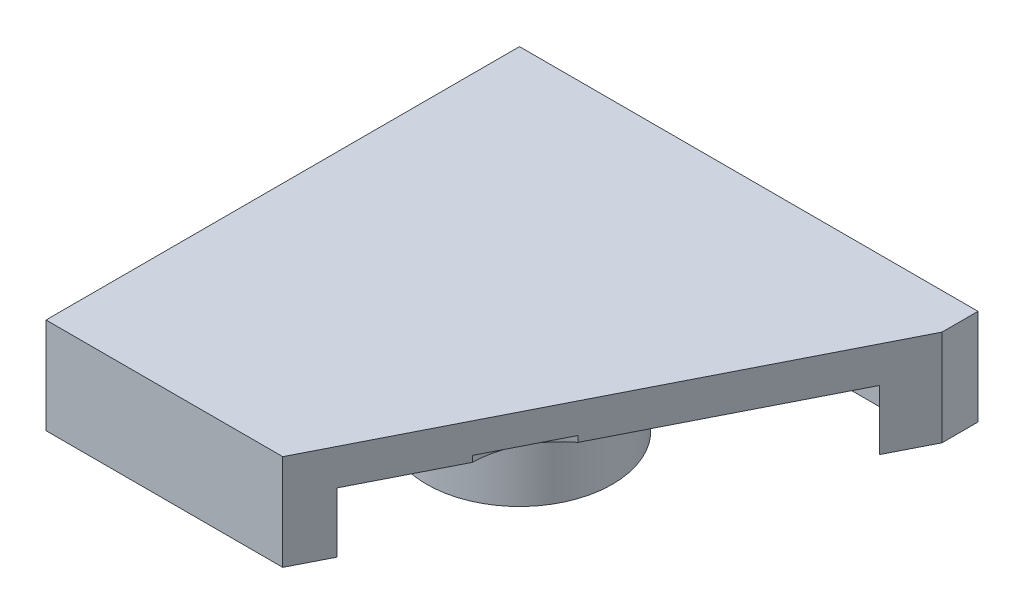
from build123d import *

# Parameters (mm, degrees)
MAINBASESKETCH_W          = 15.8
MAINBASESKETCH_H          = 3.2
MAINBASEEXTRUDE_DEPTH     = 7.9
MAINBASESHELL_T           = -1.2
UNDERSIDECIRCLEEXT_START  = -0.2
UNDERSIDECIRCLESKETCH_R   = 3.1
UNDERSIDECIRCLESKETCH_R_2 = 2.4
UNDERSIDECIRCLEEXT_DEPTH  = 2.2
ANGLEDCUT_DEPTH           = 19.555463972
CUT_EXTRUDE16_DEPTH       = 2.2


with BuildPart() as part:
    # MainBaseSketch → MainBaseExtrude (new, symmetric)
    with BuildSketch(Plane.XY):
        with Locations((8.581967213, 1.6)):
            Rectangle(MAINBASESKETCH_W, MAINBASESKETCH_H)
    extrude(amount=MAINBASEEXTRUDE_DEPTH, both=True)

    # MainBaseShell
    mainbaseshell_openings = [part.faces().sort_by_distance(p)[0] for p in [
        (8.581967213, 0, 0),
    ]]
    offset(amount=MAINBASESHELL_T, openings=mainbaseshell_openings, kind=Kind.INTERSECTION)

    # UnderSideCircleSketch → UnderSideCircleExt (add)
    with BuildSketch(Plane.XZ.offset(-2).offset(UNDERSIDECIRCLEEXT_START)):
        with Locations((8.581967213, 0)):
            Circle(UNDERSIDECIRCLESKETCH_R)
        with Locations((8.581967213, 0)):
            Circle(UNDERSIDECIRCLESKETCH_R_2, mode=Mode.SUBTRACT)
    extrude(amount=UNDERSIDECIRCLEEXT_DEPTH)

    # AngledCutSketch → AngledCut (cut, through all)
    with BuildSketch(Plane.XZ):
        Polygon((8.7465188, 7.575344166), (15.981967213, -6.7), (15.981967213, -7.9), (16.481967213, -7.9), (16.481967213, 7.9), (8.581967213, 7.9), align=None)
    extrude(amount=-ANGLEDCUT_DEPTH, mode=Mode.SUBTRACT)

    # AngledNotchSketch → Cut-Extrude16 (cut)
    with BuildSketch(Plane(origin=(0, 0, 0), x_dir=(-1, 0, 0), z_dir=(0, -1, 0))):
        with BuildLine():
            Line((-10.711153505, -3.699172992), (-11.897271127, -1.358994981))
            ThreePointArc((-11.897271127, -1.358994981), (-11.034832221, -2.39254887), (-10.711153505, -3.699172992))
        make_face()
    extrude(amount=-CUT_EXTRUDE16_DEPTH, mode=Mode.SUBTRACT)


solid = part.part
